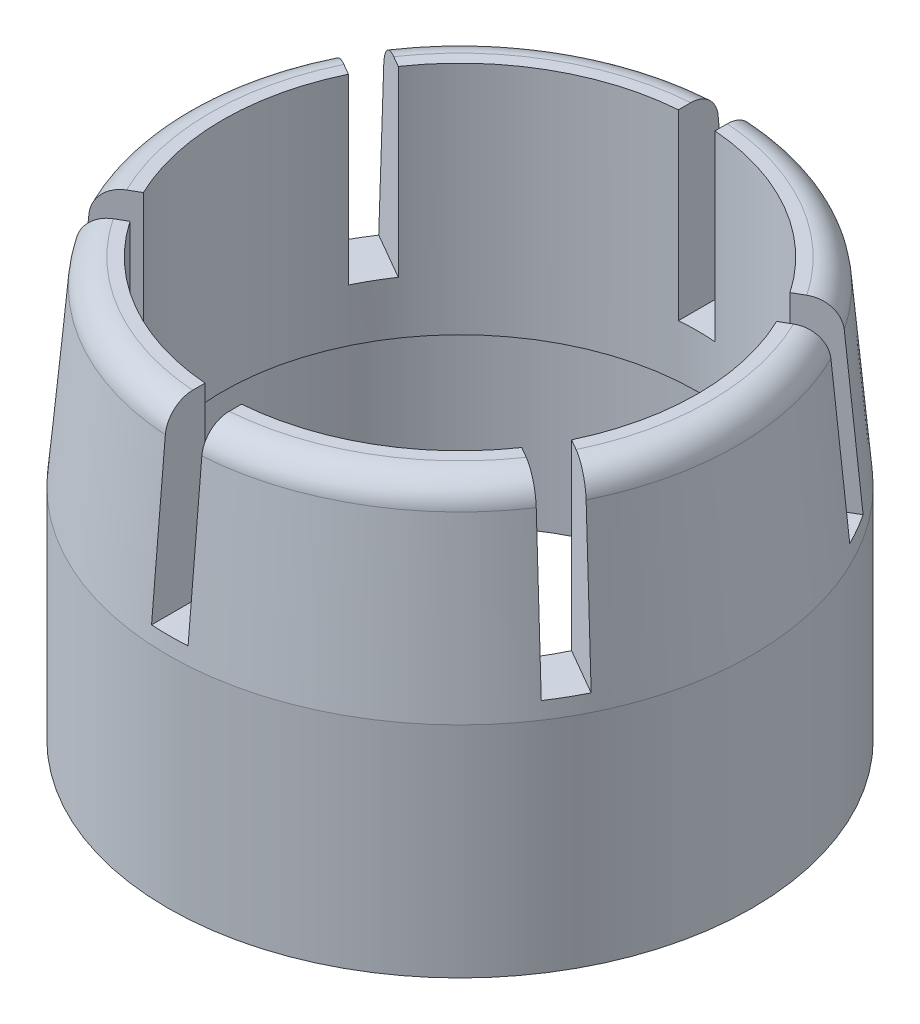
from build123d import *

# Parameters (mm, degrees)
SKETCH3_W          = 2
SKETCH3_H          = 10.621146273
CUT_EXTRUDE1_DEPTH = 10
CIRPATTERN1_COUNT  = 6


with BuildPart() as part:
    # Sketch1 → Revolve1 (revolve)
    with BuildSketch(Plane.XY, mode=Mode.PRIVATE) as revolve1_sk:
        with BuildLine():
            Line((14.3, -2.973065008), (16, -2.973065008))
            Line((16, -2.973065008), (16, 9.026934992))
            Line((16, 9.026934992), (15.169972376, 18.53735267))
            ThreePointArc((15.169972376, 18.53735267), (14.689154937, 19.512743863), (13.675652722, 19.906934992))
            Line((13.675652722, 19.906934992), (13, 19.906934992))
            Line((13, 19.906934992), (13, 7.026934992))
            Line((13, 7.026934992), (14.3, 7.026934992))
            Line((14.3, 7.026934992), (14.3, -2.973065008))
        make_face()
    revolve(revolve1_sk.sketch.rotate(Axis((0, 0, 0), (0, 1, 0)), 90), axis=Axis((0, 0, 0), (0, 1, 0)))

    # Sketch3 → Cut-Extrude1 (cut)
    with BuildSketch(Plane(origin=(0, 19.906934992, 0), x_dir=(1, 0, 0), z_dir=(0, 1, 0))):
        with Locations((0, 13.675652722)):
            Rectangle(SKETCH3_W, SKETCH3_H)
    cut_extrude1 = extrude(amount=-CUT_EXTRUDE1_DEPTH, mode=Mode.SUBTRACT)

    # CirPattern1: Cut-Extrude1 ×6 about axis
    cirpattern1_axis = Axis((0, 0, 0), (0, 1, 0))
    for i in range(1, CIRPATTERN1_COUNT):
        add(cut_extrude1.rotate(cirpattern1_axis, i * 360 / CIRPATTERN1_COUNT), mode=Mode.SUBTRACT)


solid = part.part
